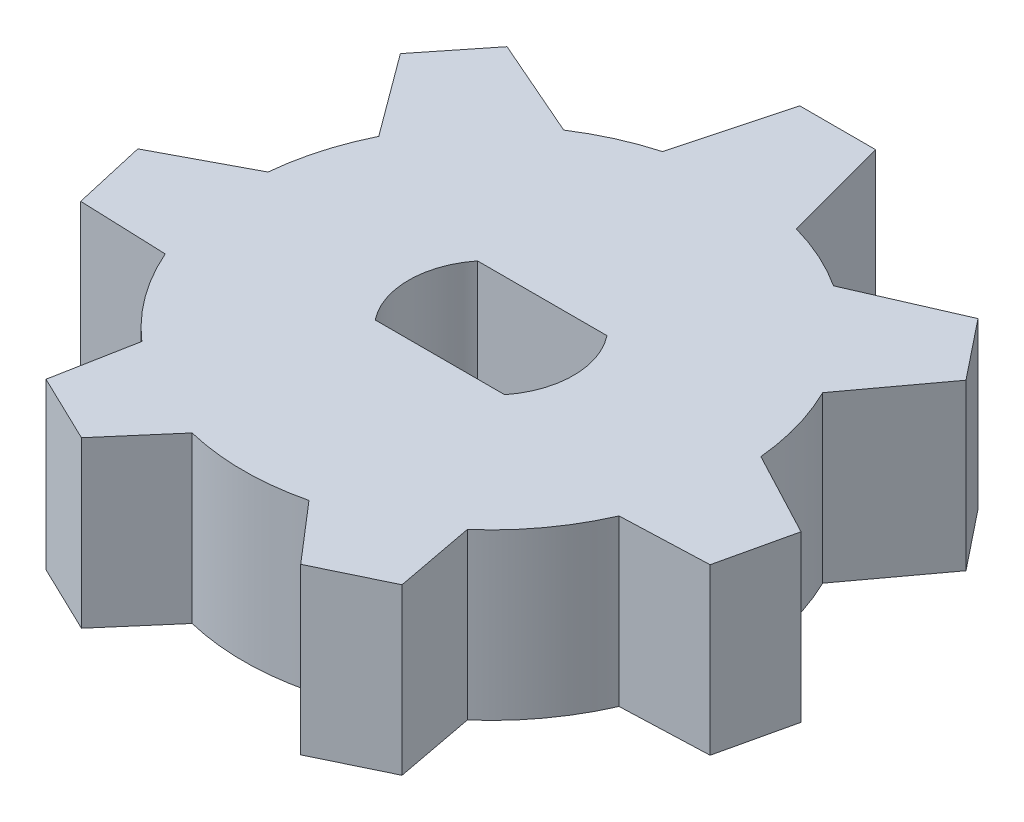
from build123d import *

# Parameters (mm, degrees)
SKIZZE1_R                       = 7.5
AUFSATZ_LINEAR_AUSTRAGEN1_DEPTH = 5
AUFSATZ_LINEAR_AUSTRAGEN2_DEPTH = 5
KREISMUSTER1_COUNT              = 7
SCHNITT_LINEAR_AUSTRAGEN1_DEPTH = 5


with BuildPart() as part:
    # Skizze1 → Aufsatz-Linear austragen1 (new body)
    with BuildSketch(Plane(origin=(0, 0, 0), x_dir=(1, 0, 0), z_dir=(0, 1, 0))):
        with Locations(Location((0, 0, 0), (0, 0, 270))):
            Circle(SKIZZE1_R)
    extrude(amount=AUFSATZ_LINEAR_AUSTRAGEN1_DEPTH)

    # Skizze2 → Aufsatz-Linear austragen2 (add)
    with BuildSketch(Plane(origin=(0, 5, 0), x_dir=(1, 0, 0), z_dir=(0, 1, 0))):
        Polygon((-1.15, 10.5), (1.15, 10.5), (2.087822174, 7), (-2.087822174, 7), align=None)
    aufsatz_linear_austragen2 = extrude(amount=-AUFSATZ_LINEAR_AUSTRAGEN2_DEPTH)

    # Kreismuster1: Aufsatz-Linear austragen2 ×7 about axis
    kreismuster1_axis = Axis((0, 0, -0.45727081), (0, 1, 0))
    for i in range(1, KREISMUSTER1_COUNT):
        add(aufsatz_linear_austragen2.rotate(kreismuster1_axis, i * 360 / KREISMUSTER1_COUNT))

    # Skizze3 → Schnitt-Linear austragen1 (cut)
    with BuildSketch(Plane(origin=(0, 5, 0), x_dir=(1, 0, 0), z_dir=(0, 1, 0))):
        with BuildLine():
            Line((1.961504525, 1.55), (-1.961504525, 1.55))
            ThreePointArc((-1.961504525, 1.55), (-2.5, 0), (-1.961504525, -1.55))
            Line((-1.961504525, -1.55), (1.961504525, -1.55))
            ThreePointArc((1.961504525, -1.55), (2.361542008, -0.820438507), (2.5, 0))
            ThreePointArc((2.5, 0), (2.361542008, 0.820438507), (1.961504525, 1.55))
        make_face()
    extrude(amount=-SCHNITT_LINEAR_AUSTRAGEN1_DEPTH, mode=Mode.SUBTRACT)


solid = part.part
